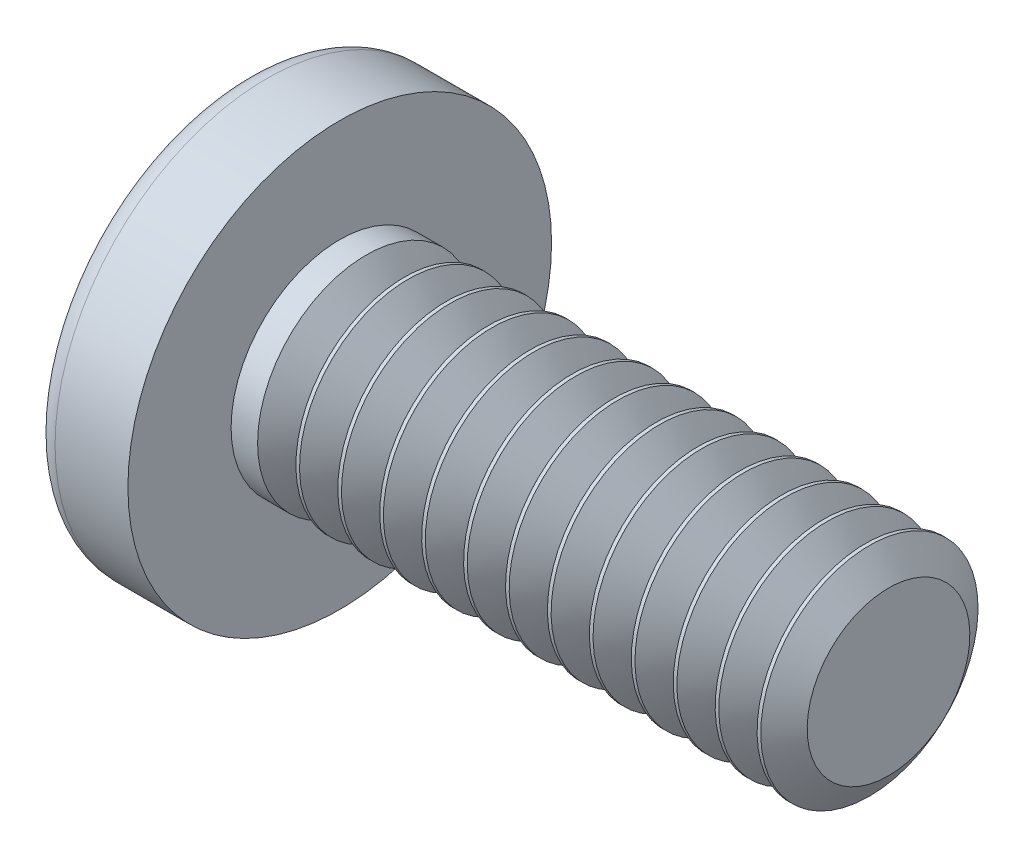
from build123d import *

# Parameters (mm, degrees)
CIRPATTERN1_COUNT = 2
CIRPATTERN1_ANGLE = 90
THDSCHPAT_COUNT   = 13
THDSCHPAT_PITCH   = 0.48514


with BuildPart() as part:
    # BodySke → Base-Revolve (revolve)
    with BuildSketch(Plane.XY, mode=Mode.PRIVATE) as base_revolve_sk:
        with BuildLine():
            Line((1.8034, 1.2573), (1.8034, 2.4511))
            Line((1.8034, 2.4511), (0.960546522, 2.4511))
            ThreePointArc((0.960546522, 2.4511), (0.844549433, 2.423066093), (0.754157474, 2.345152561))
            ThreePointArc((0.754157474, 2.345152561), (0.193176952, 1.231715676), (0, 0))
            Line((0, 0), (8.1534, 0))
            Line((8.1534, 0), (8.1534, 1.2573))
            Line((8.1534, 1.2573), (1.8034, 1.2573))
        make_face()
    revolve(base_revolve_sk.sketch.rotate(Axis((-25.4, 0, 0), (1, 0, 0)), 90), axis=Axis((-25.4, 0, 0), (1, 0, 0)))

    # Sketch3 → Cut-Loft1 section 0
    with BuildSketch(Plane(origin=(0, 0, 0), x_dir=(0, 0, -1), z_dir=(1, 0, 0))):
        with BuildLine():
            Line((0.3683, -1.5875), (-0.3683, -1.5875))
            Line((-0.3683, -1.5875), (-0.3683, 1.5875))
            Line((-0.3683, 1.5875), (0.3683, 1.5875))
            Line((0.3683, 1.5875), (0.3683, -1.5875))
        make_face()
    # Sketch4 → Cut-Loft1 section 1
    with BuildSketch(Plane(origin=(1.7526, 0, 0), x_dir=(0, 0, -1), z_dir=(1, 0, 0))):
        with BuildLine():
            Line((0.18415, -0.18415), (-0.18415, -0.18415))
            Line((-0.18415, -0.18415), (-0.18415, 0.18415))
            Line((-0.18415, 0.18415), (0.18415, 0.18415))
            Line((0.18415, 0.18415), (0.18415, -0.18415))
        make_face()
    cut_loft1 = loft(mode=Mode.SUBTRACT)

    # CirPattern1: Cut-Loft1 ×2 about axis
    cirpattern1_axis = Axis((0, 0, 0), (1, 0, 0))
    for i in range(1, CIRPATTERN1_COUNT):
        add(cut_loft1.rotate(cirpattern1_axis, i * CIRPATTERN1_ANGLE / (CIRPATTERN1_COUNT - 1)), mode=Mode.SUBTRACT)

    # ThdSchSke → ThreadSchematic (revolve, cut)
    with BuildSketch(Plane.XY, mode=Mode.PRIVATE) as threadschematic_sk:
        Polygon((2.33172, -0.94107), (2.11029337, -1.2573), (2.11029337, -1.571625), (2.55314663, -1.571625), (2.55314663, -1.2573), align=None)
    threadschematic = revolve(threadschematic_sk.sketch.rotate(Axis((-3.175, 0, 0), (1, 0, 0)), 270), axis=Axis((-3.175, 0, 0), (1, 0, 0)), mode=Mode.SUBTRACT)

    # ThdSchPat: ThreadSchematic ×13
    with Locations(*[(i * THDSCHPAT_PITCH, 0, 0) for i in range(1, THDSCHPAT_COUNT)]):
        add(threadschematic, mode=Mode.SUBTRACT)


solid = part.part
